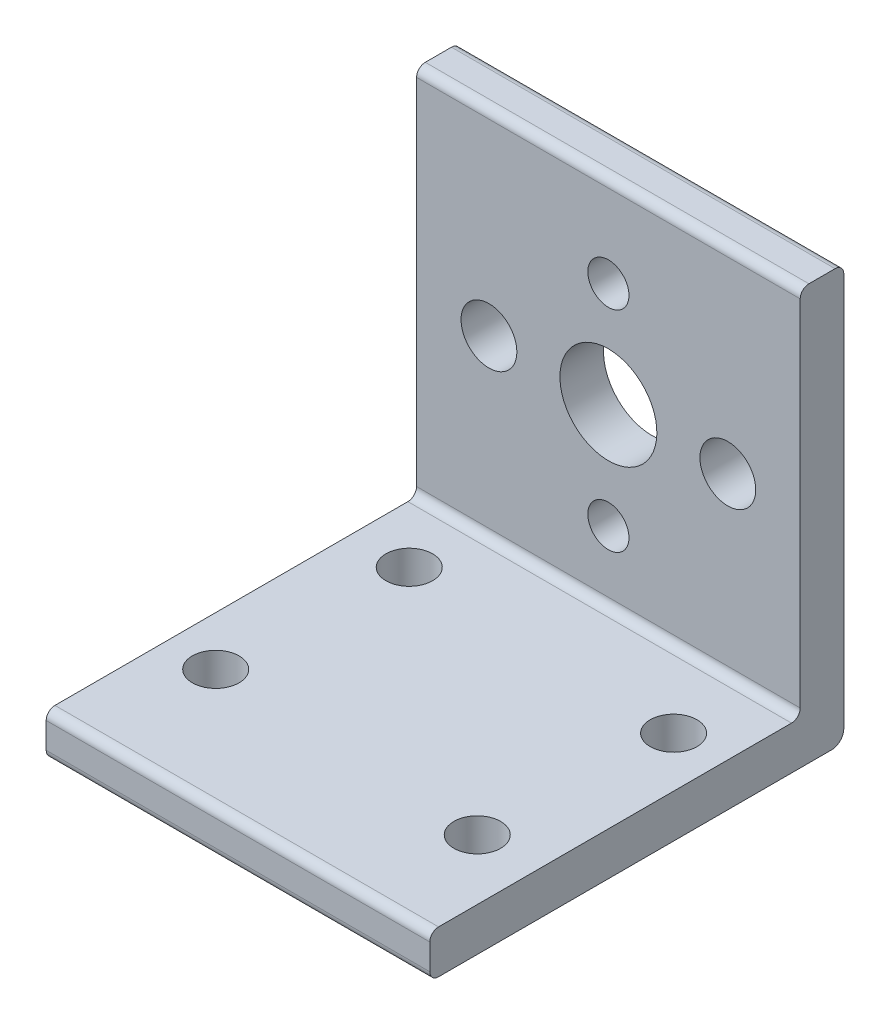
from build123d import *

# Parameters (mm, degrees)
BOSS_EXTRUDE1_DEPTH     = 27.94
SKETCH2_R               = 3.5306
SKETCH2_R_2             = 1.4986
SKETCH2_R_3             = 2.032
MOTOR_MOUNT_HOLES_DEPTH = 52.022202187
SKETCH3_R               = 1.7018
PLATE_MOUNT_HOLES_DEPTH = 52.022202187
FILLET1_R               = 0.635
FILLET2_R               = 0.889
FILLET3_R               = 0.635


with BuildPart() as part:
    # Sketch1 → Boss-Extrude1 (new body)
    with BuildSketch(Plane(origin=(0, 0, 0), x_dir=(0, 0, -1), z_dir=(1, 0, 0))):
        Polygon((0, 0), (0, -30.226), (-30.1498, -30.226), (-30.1498, -27.0764), (-3.175, -27.0764), (-3.175, 0), align=None)
    extrude(amount=BOSS_EXTRUDE1_DEPTH)

    # Sketch2 → Motor_Mount_holes (cut, through all)
    with BuildSketch(Plane.XY):
        with Locations(Location((13.97, -14.3002, 0), (0, 0, 90))):
            Circle(SKETCH2_R)
        with Locations(Location((13.97, -6.6548, 0), (0, 0, 90))):
            Circle(SKETCH2_R_2)
        with Locations(Location((5.2705, -14.3002, 0), (0, 0, 90))):
            Circle(SKETCH2_R_3)
        with Locations(Location((22.6695, -14.3002, 0), (0, 0, 180))):
            Circle(SKETCH2_R_3)
        with Locations(Location((13.97, -21.9456, 0), (0, 0, 180))):
            Circle(SKETCH2_R_2)
    extrude(amount=MOTOR_MOUNT_HOLES_DEPTH, mode=Mode.SUBTRACT)

    # Sketch3 → Plate_Mount_Holes (cut, through all)
    with BuildSketch(Plane(origin=(0, -30.226, 0), x_dir=(1, 0, 0), z_dir=(0, 1, 0))):
        with Locations(Location((4.191, -7.8994, 0), (0, 0, 90))):
            Circle(SKETCH3_R)
        with Locations(Location((24.2824, -8.7376, 0), (0, 0, 90))):
            Circle(SKETCH3_R)
        with Locations(Location((3.5814, -21.3868, 0), (0, 0, 90))):
            Circle(SKETCH3_R)
        with Locations(Location((23.5458, -22.3012, 0), (0, 0, 90))):
            Circle(SKETCH3_R)
    extrude(amount=PLATE_MOUNT_HOLES_DEPTH, mode=Mode.SUBTRACT)

    # Fillet1
    fillet1_edges = [part.edges().sort_by_distance(p)[0] for p in [
        (13.97, -27.0764, 3.175),
    ]]
    fillet(fillet1_edges, radius=FILLET1_R)

    # Fillet2
    fillet2_edges = [part.edges().sort_by_distance(p)[0] for p in [
        (13.97, -30.226, 0),
    ]]
    fillet(fillet2_edges, radius=FILLET2_R)

    # Fillet3
    fillet3_edges = [part.edges().sort_by_distance(p)[0] for p in [
        (13.97, 0, 0),
        (13.97, -30.226, 30.1498),
        (13.97, -27.0764, 30.1498),
        (13.97, 0, 3.175),
    ]]
    fillet(fillet3_edges, radius=FILLET3_R)


solid = part.part
